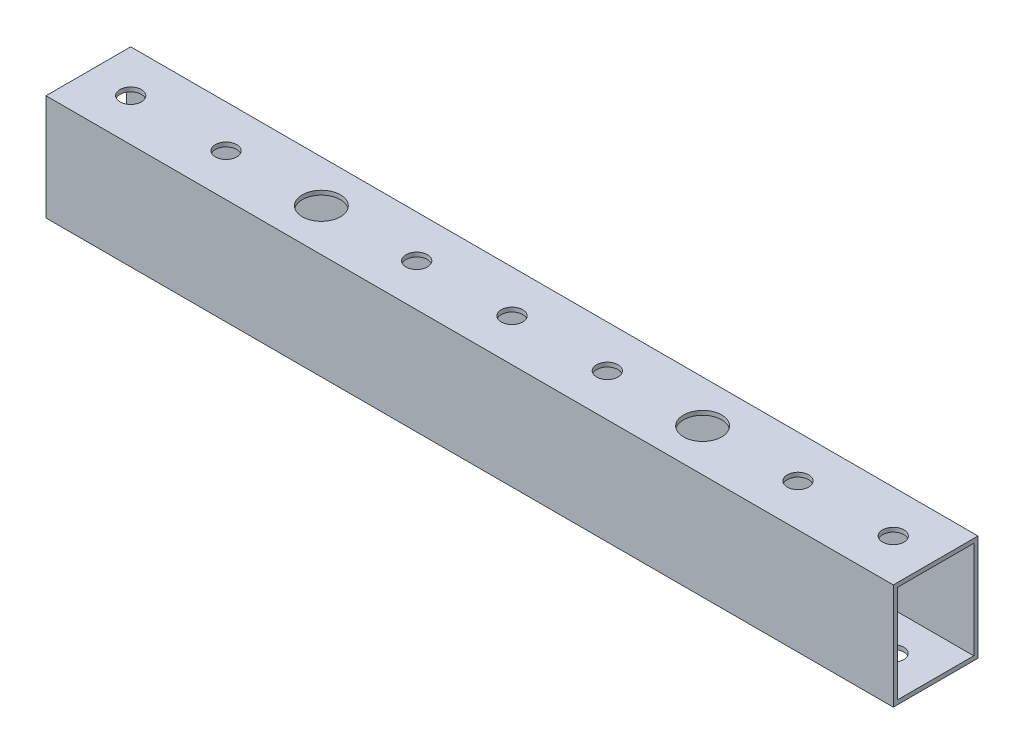
from build123d import *

# Parameters (mm, degrees)
SKETCH_1_W          = 20
SKETCH_1_H          = 25
SKETCH_1_W_2        = 18
SKETCH_1_H_2        = 23
EXTRUDE_1_DEPTH     = 100
SKETCH_2_R          = 2.525
CUT_EXTRUDE_1_DEPTH = 5
SKETCH_4_R          = 2.5
CUT_EXTRUDE_3_DEPTH = 5
SKETCH_5_R          = 4.5
CUT_EXTRUDE_4_DEPTH = 2
SKETCH_6_R          = 2.525
CUT_EXTRUDE_5_DEPTH = 2
SKETCH_7_R          = 2.525
CUT_EXTRUDE_6_DEPTH = 10


with BuildPart() as part:
    # 草图1 → 凸台-拉伸1 (new, symmetric)
    with BuildSketch(Plane(origin=(0, 0, 0), x_dir=(0, 0, -1), z_dir=(1, 0, 0))):
        Rectangle(SKETCH_1_W, SKETCH_1_H)
        Rectangle(SKETCH_1_W_2, SKETCH_1_H_2, mode=Mode.SUBTRACT)
    extrude(amount=EXTRUDE_1_DEPTH, both=True)

    # 草图2 → 切除-拉伸1 (cut, symmetric)
    with BuildSketch(Plane(origin=(0, 12.5, 0), x_dir=(1, 0, 0), z_dir=(0, 1, 0))):
        with Locations(Location((0, 0, 0), (0, 0, 90))):
            Circle(SKETCH_2_R)
        with Locations(Location((-90, 0, 0), (0, 0, 90))):
            Circle(SKETCH_2_R)
        with Locations(Location((90, 0, 0), (0, 0, 90))):
            Circle(SKETCH_2_R)
    extrude(amount=CUT_EXTRUDE_1_DEPTH, both=True, mode=Mode.SUBTRACT)

    # 草图4 → 切除-拉伸3 (cut, symmetric)
    with BuildSketch(Plane(origin=(0, -11.5, 0), x_dir=(1, 0, 0), z_dir=(0, 1, 0))):
        with Locations(Location((-90, 0, 0), (0, 0, 270))):
            Circle(SKETCH_4_R)
        with Locations(Location((0, 0, 0), (0, 0, 270))):
            Circle(SKETCH_4_R)
        with Locations(Location((90, 0, 0), (0, 0, 270))):
            Circle(SKETCH_4_R)
    extrude(amount=CUT_EXTRUDE_3_DEPTH, both=True, mode=Mode.SUBTRACT)

    # 草图5 → 切除-拉伸4 (cut)
    with BuildSketch(Plane(origin=(0, 12.5, 0), x_dir=(1, 0, 0), z_dir=(0, 1, 0))):
        with Locations(Location((-45, 0, 0), (0, 0, 270))):
            Circle(SKETCH_5_R)
        with Locations(Location((45, 0, 0), (0, 0, 270))):
            Circle(SKETCH_5_R)
    extrude(amount=-CUT_EXTRUDE_4_DEPTH, mode=Mode.SUBTRACT)

    # 草图6 → 切除-拉伸5 (cut)
    with BuildSketch(Plane(origin=(0, -11.5, 0), x_dir=(1, 0, 0), z_dir=(0, 1, 0))):
        with Locations(Location((-45, 0, 0), (0, 0, 270))):
            Circle(SKETCH_6_R)
        with Locations(Location((45, 0, 0), (0, 0, 270))):
            Circle(SKETCH_6_R)
    extrude(amount=-CUT_EXTRUDE_5_DEPTH, mode=Mode.SUBTRACT)

    # 草图7 → 切除-拉伸6 (cut)
    with BuildSketch(Plane(origin=(0, 12.5, 0), x_dir=(1, 0, 0), z_dir=(0, 1, 0))):
        with Locations(Location((-67.5, 0, 0), (0, 0, 270))):
            Circle(SKETCH_7_R)
        with Locations(Location((-22.5, 0, 0), (0, 0, 270))):
            Circle(SKETCH_7_R)
        with Locations(Location((22.5, 0, 0), (0, 0, 270))):
            Circle(SKETCH_7_R)
        with Locations(Location((67.5, 0, 0), (0, 0, 270))):
            Circle(SKETCH_7_R)
    extrude(amount=-CUT_EXTRUDE_6_DEPTH, mode=Mode.SUBTRACT)


solid = part.part
